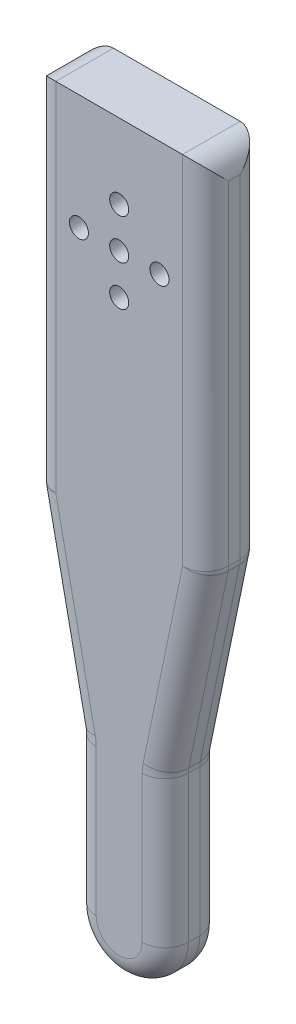
from build123d import *

# Parameters (mm, degrees)
SKETCH2_W           = 30
SKETCH2_H           = 130
BOSS_EXTRUDE1_DEPTH = 10
CUT_EXTRUDE3_DEPTH  = 75.64013832
FILLET3_RADIUS      = 8
FILLET3_LENGTH      = 10
FILLET4_R           = 4
SKETCH3_R           = 1.65
CUT_EXTRUDE4_DEPTH  = 75.64013841


with BuildPart() as part:
    # Sketch2 → Boss-Extrude1 (new body)
    with BuildSketch(Plane.XY):
        with Locations((-14.802371542, -2.697628458)):
            Rectangle(SKETCH2_W, SKETCH2_H)
    extrude(amount=BOSS_EXTRUDE1_DEPTH)

    # Sketch6 → Cut-Extrude3 (cut, through all)
    with BuildSketch(Plane.XY.offset(10)):
        Polygon((-29.802371542, -67.697628458), (-22.802371542, -67.697628458), (-22.802371542, -33.848814229), (-29.802371542, 0), align=None)
        Polygon((0.197628458, -67.697628458), (-6.802371542, -67.697628458), (-6.802371542, -33.848814229), (0.197628458, 0), align=None)
    extrude(amount=-CUT_EXTRUDE3_DEPTH, mode=Mode.SUBTRACT)

    # Fillet3: full round fillet: the end face becomes a half cylinder, R = half its width
    fillet3_face = Plane((-14.802371542, -67.697628458, 5), x_dir=(0, 0, 1), z_dir=(0, -1, 0))  # on the end face: x along it, z out of the body
    fillet3_slab = fillet3_face.offset(-FILLET3_RADIUS / 2) * Box(FILLET3_LENGTH, 2 * FILLET3_RADIUS, FILLET3_RADIUS, mode=Mode.PRIVATE)  # the body's end, R deep
    fillet3_round = Plane((-14.802371542, -59.697628458, 5), x_dir=(0, -1, 0), z_dir=(0, 0, 1)) * Cylinder(FILLET3_RADIUS, FILLET3_LENGTH, mode=Mode.PRIVATE)  # its axis R under the face
    add(fillet3_slab - fillet3_round, mode=Mode.SUBTRACT)

    # Fillet4
    fillet4_edges = [part.edges().sort_by_distance(p)[0] for p in [
        (0.197628458, 31.151185771, 0),
        (0.197628458, 31.151185771, 10),
        (-3.302371542, -16.924407115, 10),
        (-6.802371542, -33.848814229, 5),
        (0.197628458, 0, 5),
        (-3.302371542, -16.924407115, 0),
        (-26.302371542, -16.924407115, 10),
        (-29.802371542, 0, 5),
        (-22.802371542, -33.848814229, 5),
        (-26.302371542, -16.924407115, 0),
        (-22.802371542, -46.773221344, 10),
        (-22.802371542, -46.773221344, 0),
        (-6.802371542, -46.773221344, 10),
        (-6.802371542, -46.773221344, 0),
        (-14.802371542, -67.697628458, 0),
        (-14.802371542, -67.697628458, 10),
        (-29.802371542, 31.151185771, 10),
        (-29.802371542, 31.151185771, 0),
        (-29.802371542, 62.302371542, 5),
        (0.197628458, 62.302371542, 5),
    ]]
    fillet(fillet4_edges, radius=FILLET4_R)

    # Sketch3 → Cut-Extrude4 (cut, through all)
    with BuildSketch(Plane.XY.offset(10)):
        with Locations((-21.802371542, 42.302371542)):
            Circle(SKETCH3_R)
        with Locations((-14.802371542, 49.302371542)):
            Circle(SKETCH3_R)
        with Locations((-7.802371542, 42.302371542)):
            Circle(SKETCH3_R)
        with Locations((-14.802371542, 35.302371542)):
            Circle(SKETCH3_R)
        with Locations((-14.802371542, 42.302371542)):
            Circle(SKETCH3_R)
    extrude(amount=-CUT_EXTRUDE4_DEPTH, mode=Mode.SUBTRACT)


solid = part.part
